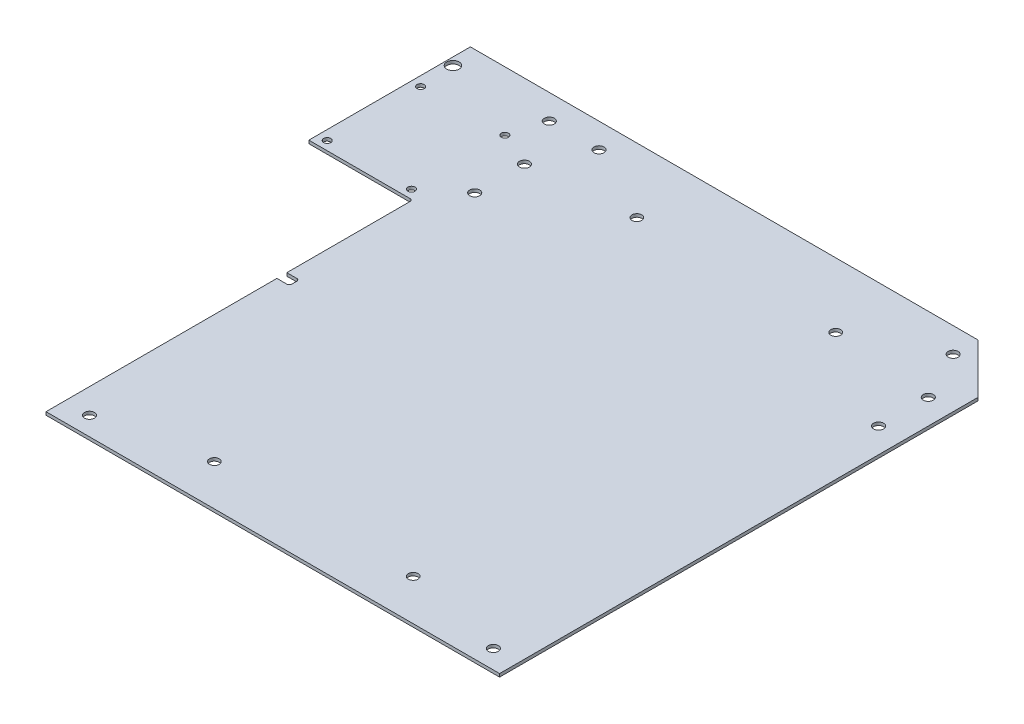
from build123d import *

# Parameters (mm, degrees)
BOSS_EXTRUDE1_DEPTH         = 1.5875
F_10_CLEARANCE_HOLE1_D      = 5.1054
F_1_4_0_25_DIAMETER_HOLE1_D = 6.35
F_6_CLEARANCE_HOLE1_D       = 3.6576
CUT_EXTRUDE1_DEPTH          = 306.201250484
F_10_CLEARANCE_HOLE2_D      = 4.9784


with BuildPart() as part:
    # Sketch3 → Boss-Extrude1 (new body)
    with BuildSketch(Plane(origin=(0, 0, 0), x_dir=(1, 0, 0), z_dir=(0, 1, 0))):
        with BuildLine():
            Line((-96.156504648, -3.621534833), (-96.156504648, 182.433465164))
            ThreePointArc((-96.156504648, 182.433465164), (-96.528479036, 183.331490776), (-97.426504648, 183.703465164))
            Line((-97.426504648, 183.703465164), (-149.179004653, 183.703465164))
            Line((-149.179004653, 183.703465164), (-149.179004653, 266.253465164))
            Line((-149.179004653, 266.253465164), (-70.756504695, 266.253465164))
            Line((-70.756504695, 266.253465164), (110.218495881, 266.253465164))
            Line((110.218495881, 266.253465164), (135.618495855, 240.853465164))
            Line((135.618495855, 240.853465164), (135.618495855, -3.621534833))
            Line((135.618495855, -3.621534833), (-96.156504648, -3.621534833))
        make_face()
    extrude(amount=BOSS_EXTRUDE1_DEPTH)

    # #10 Clearance Hole1 (through all)
    with Locations(Plane(origin=(0, 1.5875, 0), x_dir=(1, 0, 0), z_dir=(0, 1, 0))):
        with Locations((-83.456504653, -25.846534328), (-83.456504653, 202.75346618), (-83.456504653, 228.15346618), (-70.756504653, 253.55346618), (122.918495855, 202.753465164), (122.918495855, 228.153465164), (110.218495855, 253.553465164), (-83.456504653, 5.903465672), (122.918495855, 5.903465672), (-96.15650472, 253.553466178)):
            Hole(F_10_CLEARANCE_HOLE1_D / 2)

    # 1/4 (0.25) Diameter Hole1 (through all)
    with Locations(Plane(origin=(0, 0, 0), x_dir=(-1, 0, 0), z_dir=(0, -1, 0))):
        with Locations((145.369004653, 253.553465164)):
            Hole(F_1_4_0_25_DIAMETER_HOLE1_D / 2)

    # #6 Clearance Hole1 (through all)
    with Locations(Plane(origin=(0, 1.5875, 0), x_dir=(1, 0, 0), z_dir=(0, 1, 0))):
        with Locations((-144.305157527, 235.976041671), (-144.305157527, 188.226395138), (-101.258714708, 188.226395138), (-101.258714708, 235.978395138)):
            Hole(F_6_CLEARANCE_HOLE1_D / 2)

    # Sketch17 → Cut-Extrude1 (cut, through all)
    with BuildSketch(Plane(origin=(0, 1.5875, 0), x_dir=(1, 0, 0), z_dir=(0, 1, 0))):
        with BuildLine():
            Line((-96.156504648, 114.361465167), (-91.076504648, 114.361465167))
            ThreePointArc((-91.076504648, 114.361465167), (-90.178479036, 114.733439555), (-89.806504648, 115.631465167))
            Line((-89.806504648, 115.631465167), (-89.806504648, 118.171465167))
            ThreePointArc((-89.806504648, 118.171465167), (-90.178479036, 119.069490779), (-91.076504648, 119.441465167))
            Line((-91.076504648, 119.441465167), (-96.156504648, 119.441465167))
            Line((-96.156504648, 119.441465167), (-96.156504648, 114.361465167))
        make_face()
    extrude(amount=-CUT_EXTRUDE1_DEPTH, mode=Mode.SUBTRACT)

    # #10 Clearance Hole2 (through all)
    with Locations(Plane(origin=(0, 1.5875, 0), x_dir=(1, 0, 0), z_dir=(0, 1, 0))):
        with Locations((-31.069004399, 233.22189625), (70.530995601, 233.22189625), (70.530995601, 17.32189625), (-31.069004399, 17.32189625)):
            Hole(F_10_CLEARANCE_HOLE2_D / 2)


solid = part.part
